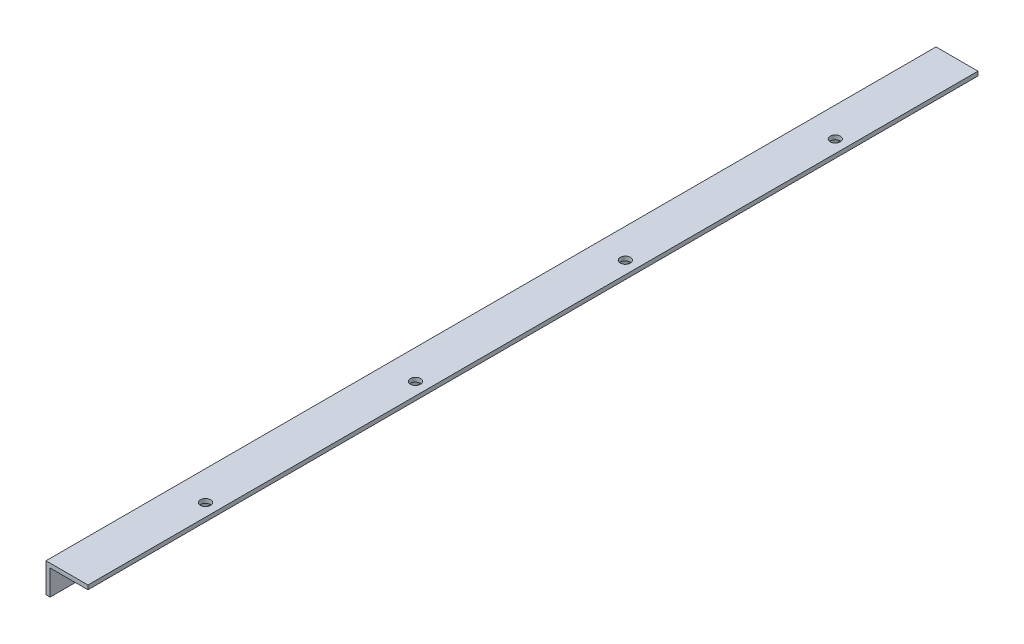
from build123d import *

# Parameters (mm, degrees)
EXTRUDE_1_DEPTH       = 212
HOLE_WIZARD_M21_D     = 2.4
HOLE_WIZARD_M21_DEPTH = 5
HOLE_WIZARD_M21_TIP   = 0.721032743


with BuildPart() as part:
    # Эскиз1 → Бобышка-Вытянуть1 (new body)
    with BuildSketch(Plane.XY):
        Polygon((0, 0), (0, 7), (10, 7), (10, 6), (1, 6), (1, 0), align=None)
    extrude(amount=EXTRUDE_1_DEPTH)

    # Отверстие с зазором M21
    with Locations(Plane(origin=(0, 7, 0), x_dir=(-1, 0, 0), z_dir=(0, 1, 0))):
        with Locations((-7, 131), (-7, 81), (-7, 31), (-7, 181)):
            Hole(HOLE_WIZARD_M21_D / 2, depth=HOLE_WIZARD_M21_DEPTH)
            with Locations((0, 0, -(HOLE_WIZARD_M21_DEPTH + HOLE_WIZARD_M21_TIP / 2))):  # 118° drill point
                Cone(0, HOLE_WIZARD_M21_D / 2, HOLE_WIZARD_M21_TIP, mode=Mode.SUBTRACT)


solid = part.part
